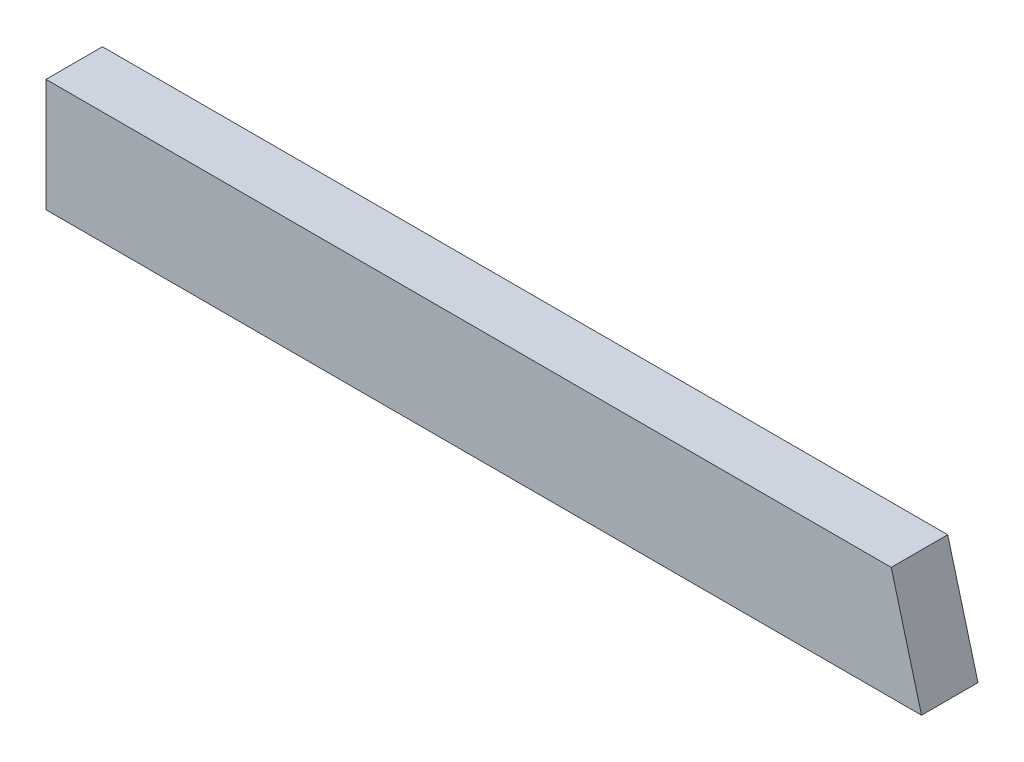
from build123d import *

# Parameters (mm, degrees)
BOSS_EXTRUDE1_DEPTH = 50.8


with BuildPart() as part:
    # Sketch1 → Boss-Extrude1 (new body)
    with BuildSketch(Plane.XY):
        Polygon((0, 0), (787.4, 0), (760.176362049, 101.6), (0, 101.6), align=None)
    extrude(amount=BOSS_EXTRUDE1_DEPTH)


solid = part.part
